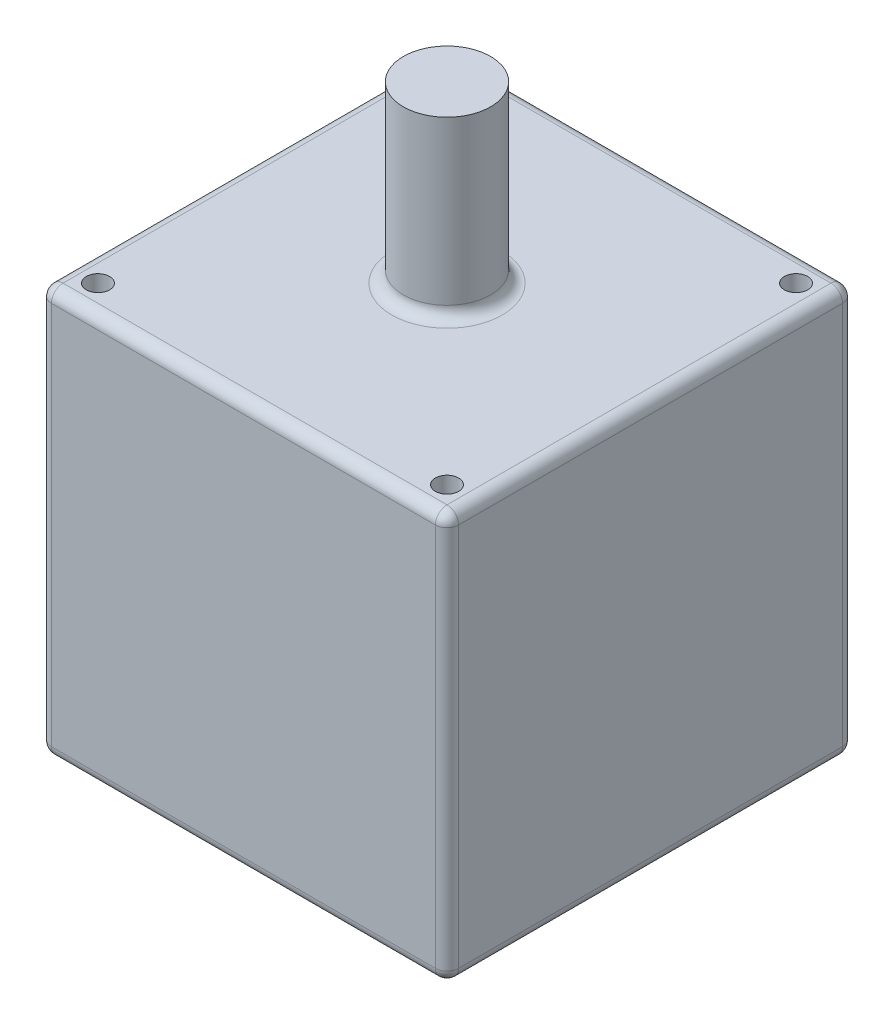
from build123d import *

# Parameters (mm, degrees)
SKETCH1_W                 = 35
SKETCH1_H                 = 35
BOSS_EXTRUDE1_DEPTH       = 35
SKETCH2_R                 = 3.75
BOSS_EXTRUDE2_DEPTH       = 15
FILLET1_R                 = 1
F_2_0MM_DOWEL_HOLE1_D     = 2
F_2_0MM_DOWEL_HOLE1_DEPTH = 10
F_2_0MM_DOWEL_HOLE1_TIP   = 0.600860619


with BuildPart() as part:
    # Sketch1 → Boss-Extrude1 (new body)
    with BuildSketch(Plane(origin=(0, 0, 0), x_dir=(1, 0, 0), z_dir=(0, 1, 0))):
        Rectangle(SKETCH1_W, SKETCH1_H)
    extrude(amount=BOSS_EXTRUDE1_DEPTH)

    # Sketch2 → Boss-Extrude2 (add)
    with BuildSketch(Plane(origin=(0, 35, 0), x_dir=(1, 0, 0), z_dir=(0, 1, 0))):
        with Locations(Location((0, 0, 0), (0, 0, 270))):
            Circle(SKETCH2_R)
    extrude(amount=BOSS_EXTRUDE2_DEPTH)

    # Fillet1
    fillet1_edges = [part.edges().sort_by_distance(p)[0] for p in [
        (-17.5, 35, 0),
        (0, 35, 17.5),
        (0, 35, -3.75),
        (17.5, 35, 0),
        (0, 0, 17.5),
        (-17.5, 0, 0),
        (0, 0, -17.5),
        (17.5, 0, 0),
        (0, 35, -17.5),
        (17.5, 17.5, 17.5),
        (-17.5, 17.5, 17.5),
        (-17.5, 17.5, -17.5),
        (17.5, 17.5, -17.5),
    ]]
    fillet(fillet1_edges, radius=FILLET1_R)

    # Ø2.0mm Dowel Hole1
    with Locations(Plane(origin=(0, 35, 0), x_dir=(1, 0, 0), z_dir=(0, 1, 0))):
        with Locations((-15, 15), (15, 15), (15, -15), (-15, -15)):
            Hole(F_2_0MM_DOWEL_HOLE1_D / 2, depth=F_2_0MM_DOWEL_HOLE1_DEPTH)
            with Locations((0, 0, -(F_2_0MM_DOWEL_HOLE1_DEPTH + F_2_0MM_DOWEL_HOLE1_TIP / 2))):  # 118° drill point
                Cone(0, F_2_0MM_DOWEL_HOLE1_D / 2, F_2_0MM_DOWEL_HOLE1_TIP, mode=Mode.SUBTRACT)


solid = part.part
